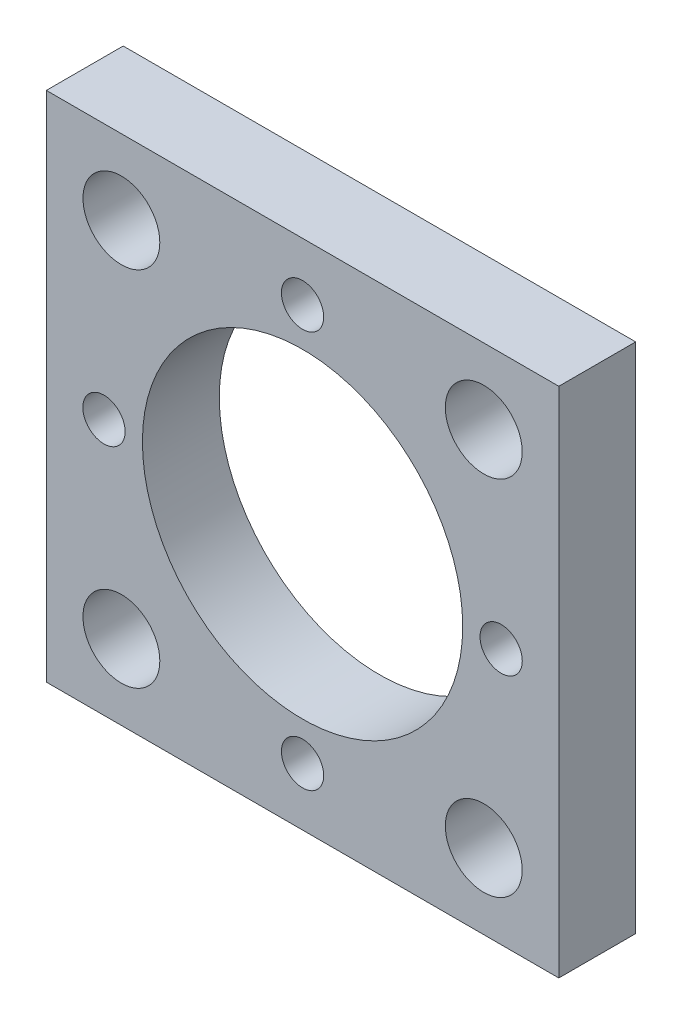
from build123d import *

# Parameters (mm, degrees)
SKETCH1_W               = 40
SKETCH1_H               = 40
BOSS_EXTRUDE1_DEPTH     = 6
F_6_0MM_DOWEL_HOLE1_D   = 6
SKETCH5_R               = 12.5
CUT_EXTRUDE1_DEPTH      = 57.885850613
TAP_DRILL_FOR_M4_TAP1_D = 3.3


with BuildPart() as part:
    # Sketch1 → Boss-Extrude1 (new body)
    with BuildSketch(Plane.XY):
        with Locations((20, 20)):
            Rectangle(SKETCH1_W, SKETCH1_H)
    extrude(amount=BOSS_EXTRUDE1_DEPTH)

    # Ø6.0mm Dowel Hole1 (through all)
    with Locations(Plane.XY.offset(6)):
        with Locations((5.857864376, 5.857864376), (5.857864376, 34.142135624), (34.142135624, 34.142135624), (34.142135624, 5.857864376)):
            Hole(F_6_0MM_DOWEL_HOLE1_D / 2)

    # Sketch5 → Cut-Extrude1 (cut, through all)
    with BuildSketch(Plane.XY.offset(6)):
        with Locations((20, 20)):
            Circle(SKETCH5_R)
    extrude(amount=-CUT_EXTRUDE1_DEPTH, mode=Mode.SUBTRACT)

    # Tap Drill for M4 Tap1 (through all)
    with Locations(Plane.XY.offset(6)):
        with Locations((4.5, 20), (20, 35.5), (35.5, 20), (20, 4.5)):
            Hole(TAP_DRILL_FOR_M4_TAP1_D / 2)


solid = part.part
